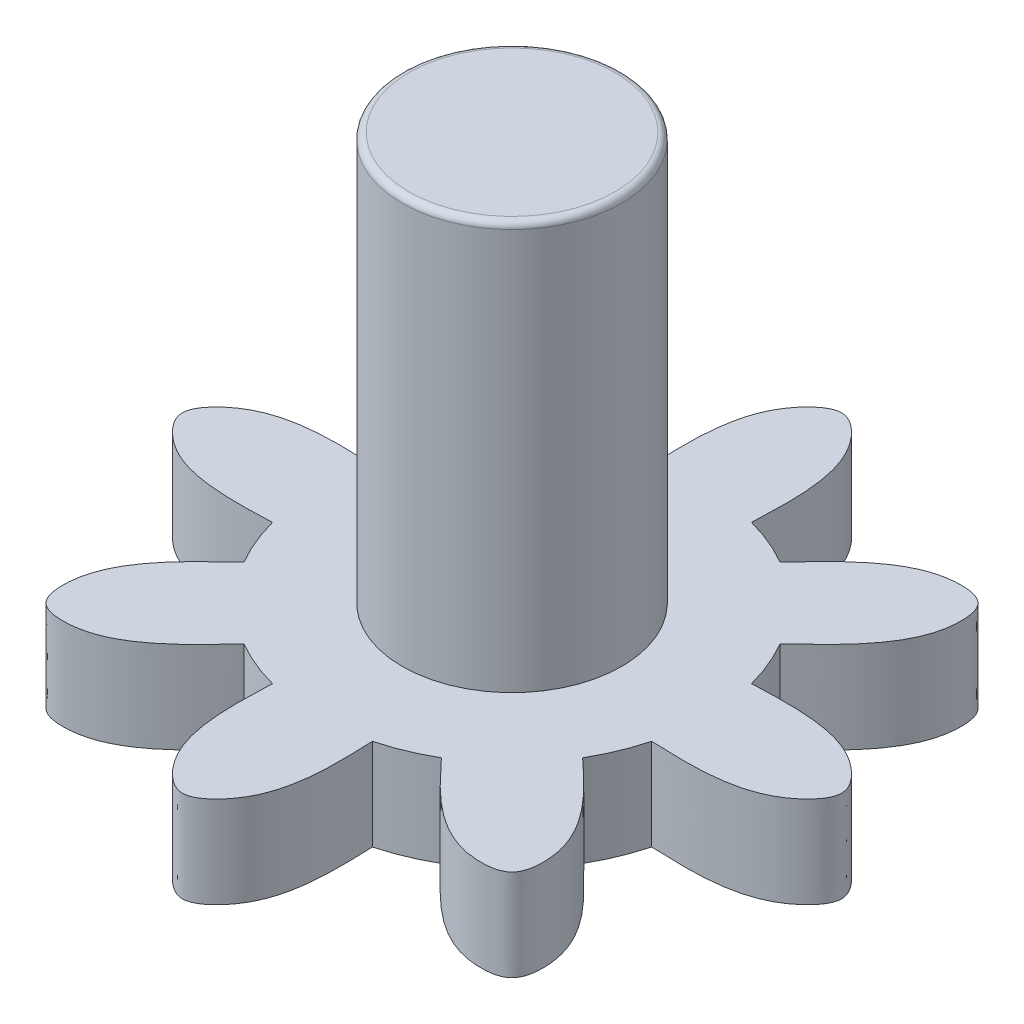
from build123d import *

# Parameters (mm, degrees)
SKETCH1_R           = 5.89
BOSS_EXTRUDE1_DEPTH = 2.75
BOSS_EXTRUDE2_DEPTH = 2.75
SKETCH4_R           = 3.3
BOSS_EXTRUDE3_DEPTH = 12.25
CIRPATTERN1_COUNT   = 8
FILLET1_R           = 0.2


with BuildPart() as part:
    # Sketch1 → Boss-Extrude1 (new body)
    with BuildSketch(Plane(origin=(0, 0, 0), x_dir=(1, 0, 0), z_dir=(0, 1, 0))):
        with Locations(Location((0, 0, 0), (0, 0, 270))):
            Circle(SKETCH1_R)
    extrude(amount=BOSS_EXTRUDE1_DEPTH)

    # Sketch3 → Boss-Extrude2 (add)
    with BuildSketch(Plane.XZ):
        with BuildLine():
            Line((-1.5, -5.69), (1.5, -5.69))
            add(Edge.make_bspline(
                [(1.5, -5.69), (1.522481898, -6.255253499), (1.574806111, -7.570820568), (1.198010999, -9.182103144), (0, -10.088973517), (-1.198010999, -9.182103144), (-1.574806111, -7.570820568), (-1.522481898, -6.255253499), (-1.5, -5.69)],
                knots=[0, 0, 0, 0, 0.178466674, 0.415362098, 0.5, 0.584637902, 0.821533326, 1, 1, 1, 1], degree=3))
        make_face()
    boss_extrude2 = extrude(amount=-BOSS_EXTRUDE2_DEPTH)

    # Sketch4 → Boss-Extrude3 (add)
    with BuildSketch(Plane(origin=(0, 2.75, 0), x_dir=(1, 0, 0), z_dir=(0, 1, 0))):
        with Locations(Location((0, 0, 0), (0, 0, 270))):
            Circle(SKETCH4_R)
    extrude(amount=BOSS_EXTRUDE3_DEPTH)

    # CirPattern1: Boss-Extrude2 ×8 about axis
    cirpattern1_axis = Axis((0, 0, 0), (0, 1, 0))
    for i in range(1, CIRPATTERN1_COUNT):
        add(boss_extrude2.rotate(cirpattern1_axis, i * 360 / CIRPATTERN1_COUNT))

    # Fillet1
    fillet1_edges = [part.edges().sort_by_distance(p)[0] for p in [
        (0, 15, -3.3),
    ]]
    fillet(fillet1_edges, radius=FILLET1_R)


solid = part.part
